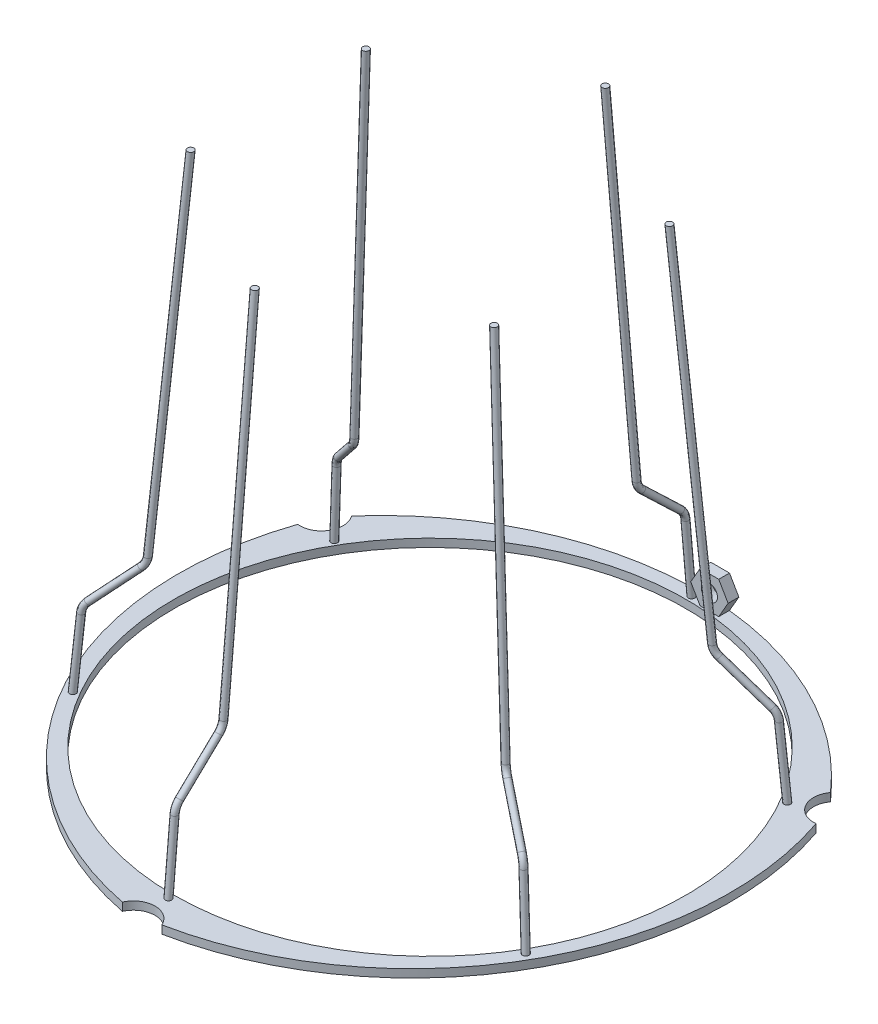
from build123d import *

# Parameters (mm, degrees)
SKETCH_2_R               = 47.5
EXTRUDE_1_DEPTH          = 1.5
SKETCH_4_R               = 0.6
PATTERN_CIRCULAR_1_COUNT = 6
SKETCH_5_R               = 1.5
EXTRUDE_2_DEPTH          = 1


with BuildPart() as part:
    # Эскиз2 → Бобышка-Вытянуть1 (new body)
    with BuildSketch(Plane(origin=(0, 0, 0), x_dir=(1, 0, 0), z_dir=(0, 1, 0))):
        with BuildLine():
            ThreePointArc((44.407595135, 29.867931627), (44.167295593, 25.5), (48.070185115, 23.524139694))
            ThreePointArc((48.070185115, 23.524139694), (43.301270189, -25), (3.66258998, -53.392071321))
            ThreePointArc((3.66258998, -53.392071321), (0, -51), (-3.66258998, -53.392071321))
            ThreePointArc((-3.66258998, -53.392071321), (-43.301270189, -25), (-48.070185115, 23.524139694))
            ThreePointArc((-48.070185115, 23.524139694), (-44.167295593, 25.5), (-44.407595135, 29.867931627))
            ThreePointArc((-44.407595135, 29.867931627), (0, 50), (44.407595135, 29.867931627))
        make_face()
        with Locations(Location((0, 0, 0), (0, 0, 270))):
            Circle(SKETCH_2_R, mode=Mode.SUBTRACT)
    extrude(amount=EXTRUDE_1_DEPTH)


with BuildPart() as body_2:
    # По траектории1: sweep along a path in Эскиз3
    with BuildLine(Plane(origin=(0, 0, 0), x_dir=(0, 0, -1), z_dir=(1, 0, 0))) as sweep_1_path:
        Line((-48.5, 1.5), (-47.362647374, 14.5))
        ThreePointArc((-47.362647374, 14.5), (-47.078277699, 15.537464785), (-46.446206356, 16.40791588))
        Line((-46.446206356, 16.40791588), (-39.214929327, 23.315059468))
        ThreePointArc((-39.214929327, 23.315059468), (-38.582857984, 24.185510563), (-38.298488309, 25.222975348))
        Line((-38.298488309, 25.222975348), (-32.5, 91.5))
    # Эскиз4 → По траектории1 (sweep)
    with BuildSketch(Plane(origin=(0, 1.5, 0), x_dir=(1, 0, 0), z_dir=(0, 1, 0))):
        with Locations((0, -48.5)):
            Circle(SKETCH_4_R)
    sweep(path=sweep_1_path.line)


with BuildPart() as pattern_circular_1_1:
    # Круговой массив1: pattern copy
    add(body_2.part.rotate(Axis((0, 50, 0), (0, -1, 0)), 1 * 360 / PATTERN_CIRCULAR_1_COUNT))


with BuildPart() as pattern_circular_1_2:
    # Круговой массив1: pattern copy
    add(body_2.part.rotate(Axis((0, 50, 0), (0, -1, 0)), 2 * 360 / PATTERN_CIRCULAR_1_COUNT))


with BuildPart() as pattern_circular_1_3:
    # Круговой массив1: pattern copy
    add(body_2.part.rotate(Axis((0, 50, 0), (0, -1, 0)), 3 * 360 / PATTERN_CIRCULAR_1_COUNT))


with BuildPart() as pattern_circular_1_4:
    # Круговой массив1: pattern copy
    add(body_2.part.rotate(Axis((0, 50, 0), (0, -1, 0)), 4 * 360 / PATTERN_CIRCULAR_1_COUNT))


with BuildPart() as pattern_circular_1_5:
    # Круговой массив1: pattern copy
    add(body_2.part.rotate(Axis((0, 50, 0), (0, -1, 0)), 5 * 360 / PATTERN_CIRCULAR_1_COUNT))


with BuildPart() as body_8:
    # Эскиз5 → Бобышка-Вытянуть2 (new, symmetric)
    with BuildSketch(Plane.XY.offset(-48.75)):
        Polygon((5.796152423, 1.5), (7.52820323, 4.5), (5.796152423, 7.5), (2.332050808, 7.5), (0.6, 4.5), (2.332050808, 1.5), align=None)
        with Locations((4.064101615, 4.5)):
            Circle(SKETCH_5_R, mode=Mode.SUBTRACT)
    extrude(amount=EXTRUDE_2_DEPTH, both=True)


solid = Compound([part.part, body_2.part, pattern_circular_1_1.part, pattern_circular_1_2.part, pattern_circular_1_3.part, pattern_circular_1_4.part, pattern_circular_1_5.part, body_8.part])
